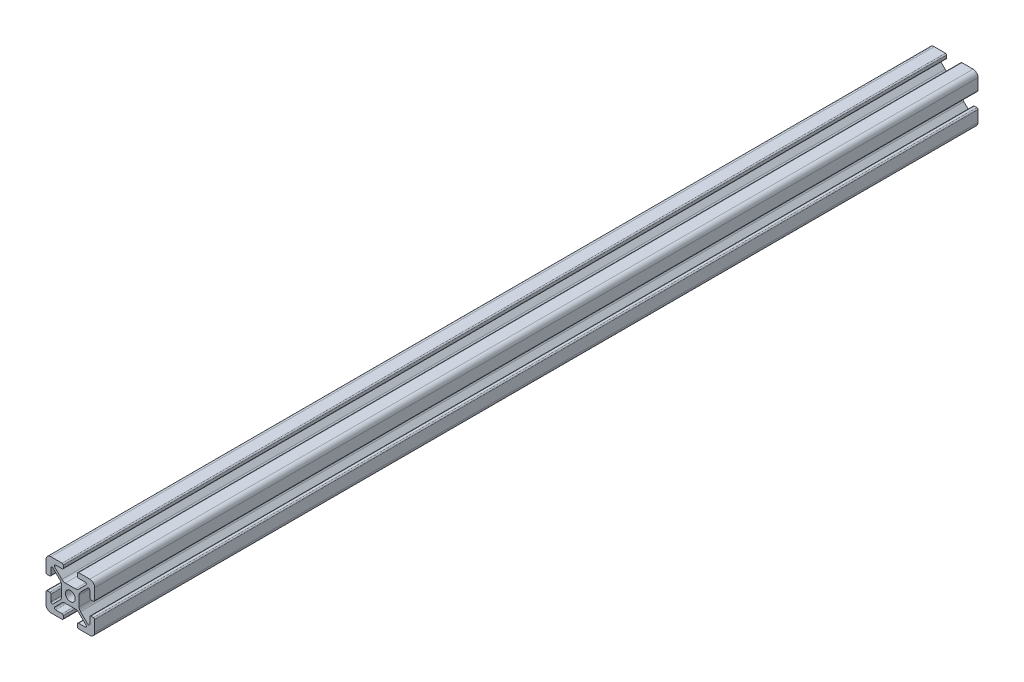
from build123d import *

# Parameters (mm, degrees)
SKETCH1_R           = 2.54
BOSS_EXTRUDE1_DEPTH = 461.264


with BuildPart() as part:
    # Sketch1 → Boss-Extrude1 (new body)
    with BuildSketch(Plane.XY):
        with BuildLine():
            Line((4.417923164, 5.315948776), (8.177961582, 9.075987194))
            ThreePointArc((8.177961582, 9.075987194), (8.315612279, 9.76800398), (7.728948776, 10.16))
            Line((7.728948776, 10.16), (4.308974388, 10.16))
            ThreePointArc((4.308974388, 10.16), (3.859961582, 10.345987194), (3.673974388, 10.795))
            Line((3.673974388, 10.795), (3.673974388, 12.065))
            ThreePointArc((3.673974388, 12.065), (3.859961582, 12.514012806), (4.308974388, 12.7))
            Line((4.308974388, 12.7), (10.16, 12.7))
            ThreePointArc((10.16, 12.7), (11.956051224, 11.956051224), (12.7, 10.16))
            Line((12.7, 10.16), (12.7, 4.308974388))
            ThreePointArc((12.7, 4.308974388), (12.514012806, 3.859961582), (12.065, 3.673974388))
            Line((12.065, 3.673974388), (10.795, 3.673974388))
            ThreePointArc((10.795, 3.673974388), (10.345987194, 3.859961582), (10.16, 4.308974388))
            Line((10.16, 4.308974388), (10.16, 7.728948776))
            ThreePointArc((10.16, 7.728948776), (9.76800398, 8.315612279), (9.075987194, 8.177961582))
            Line((9.075987194, 8.177961582), (5.315948776, 4.417923164))
            ThreePointArc((5.315948776, 4.417923164), (4.765345987, 3.593887858), (4.572, 2.621871939))
            Line((4.572, 2.621871939), (4.572, -2.621871939))
            ThreePointArc((4.572, -2.621871939), (4.765345987, -3.593887858), (5.315948776, -4.417923164))
            Line((5.315948776, -4.417923164), (9.075987194, -8.177961582))
            ThreePointArc((9.075987194, -8.177961582), (9.76800398, -8.315612279), (10.16, -7.728948776))
            Line((10.16, -7.728948776), (10.16, -4.308974388))
            ThreePointArc((10.16, -4.308974388), (10.345987194, -3.859961582), (10.795, -3.673974388))
            Line((10.795, -3.673974388), (12.065, -3.673974388))
            ThreePointArc((12.065, -3.673974388), (12.514012806, -3.859961582), (12.7, -4.308974388))
            Line((12.7, -4.308974388), (12.7, -10.16))
            ThreePointArc((12.7, -10.16), (11.956051224, -11.956051224), (10.16, -12.7))
            Line((10.16, -12.7), (4.308974388, -12.7))
            ThreePointArc((4.308974388, -12.7), (3.859961582, -12.514012806), (3.673974388, -12.065))
            Line((3.673974388, -12.065), (3.673974388, -10.795))
            ThreePointArc((3.673974388, -10.795), (3.859961582, -10.345987194), (4.308974388, -10.16))
            Line((4.308974388, -10.16), (7.728948776, -10.16))
            ThreePointArc((7.728948776, -10.16), (8.315612279, -9.76800398), (8.177961582, -9.075987194))
            Line((8.177961582, -9.075987194), (4.417923164, -5.315948776))
            ThreePointArc((4.417923164, -5.315948776), (3.593887858, -4.765345987), (2.621871939, -4.572))
            Line((2.621871939, -4.572), (-2.621871939, -4.572))
            ThreePointArc((-2.621871939, -4.572), (-3.593887858, -4.765345987), (-4.417923164, -5.315948776))
            Line((-4.417923164, -5.315948776), (-8.177961582, -9.075987194))
            ThreePointArc((-8.177961582, -9.075987194), (-8.315612279, -9.76800398), (-7.728948776, -10.16))
            Line((-7.728948776, -10.16), (-4.308974388, -10.16))
            ThreePointArc((-4.308974388, -10.16), (-3.859961582, -10.345987194), (-3.673974388, -10.795))
            Line((-3.673974388, -10.795), (-3.673974388, -12.065))
            ThreePointArc((-3.673974388, -12.065), (-3.859961582, -12.514012806), (-4.308974388, -12.7))
            Line((-4.308974388, -12.7), (-10.16, -12.7))
            ThreePointArc((-10.16, -12.7), (-11.956051224, -11.956051224), (-12.7, -10.16))
            Line((-12.7, -10.16), (-12.7, -4.308974388))
            ThreePointArc((-12.7, -4.308974388), (-12.514012806, -3.859961582), (-12.065, -3.673974388))
            Line((-12.065, -3.673974388), (-10.795, -3.673974388))
            ThreePointArc((-10.795, -3.673974388), (-10.345987194, -3.859961582), (-10.16, -4.308974388))
            Line((-10.16, -4.308974388), (-10.16, -7.728948776))
            ThreePointArc((-10.16, -7.728948776), (-9.76800398, -8.315612279), (-9.075987194, -8.177961582))
            Line((-9.075987194, -8.177961582), (-5.315948776, -4.417923164))
            ThreePointArc((-5.315948776, -4.417923164), (-4.765345987, -3.593887858), (-4.572, -2.621871939))
            Line((-4.572, -2.621871939), (-4.572, 2.621871939))
            ThreePointArc((-4.572, 2.621871939), (-4.765345987, 3.593887858), (-5.315948776, 4.417923164))
            Line((-5.315948776, 4.417923164), (-9.075987194, 8.177961582))
            ThreePointArc((-9.075987194, 8.177961582), (-9.76800398, 8.315612279), (-10.16, 7.728948776))
            Line((-10.16, 7.728948776), (-10.16, 4.308974388))
            ThreePointArc((-10.16, 4.308974388), (-10.345987194, 3.859961582), (-10.795, 3.673974388))
            Line((-10.795, 3.673974388), (-12.065, 3.673974388))
            ThreePointArc((-12.065, 3.673974388), (-12.514012806, 3.859961582), (-12.7, 4.308974388))
            Line((-12.7, 4.308974388), (-12.7, 10.16))
            ThreePointArc((-12.7, 10.16), (-11.956051224, 11.956051224), (-10.16, 12.7))
            Line((-10.16, 12.7), (-4.308974388, 12.7))
            ThreePointArc((-4.308974388, 12.7), (-3.859961582, 12.514012806), (-3.673974388, 12.065))
            Line((-3.673974388, 12.065), (-3.673974388, 10.795))
            ThreePointArc((-3.673974388, 10.795), (-3.859961582, 10.345987194), (-4.308974388, 10.16))
            Line((-4.308974388, 10.16), (-7.728948776, 10.16))
            ThreePointArc((-7.728948776, 10.16), (-8.315612279, 9.76800398), (-8.177961582, 9.075987194))
            Line((-8.177961582, 9.075987194), (-4.417923164, 5.315948776))
            ThreePointArc((-4.417923164, 5.315948776), (-3.593887858, 4.765345987), (-2.621871939, 4.572))
            Line((-2.621871939, 4.572), (2.621871939, 4.572))
            ThreePointArc((2.621871939, 4.572), (3.593887858, 4.765345987), (4.417923164, 5.315948776))
        make_face()
        with Locations(Location((0, 0, 0), (0, 0, 180))):
            Circle(SKETCH1_R, mode=Mode.SUBTRACT)
    extrude(amount=BOSS_EXTRUDE1_DEPTH)


solid = part.part
